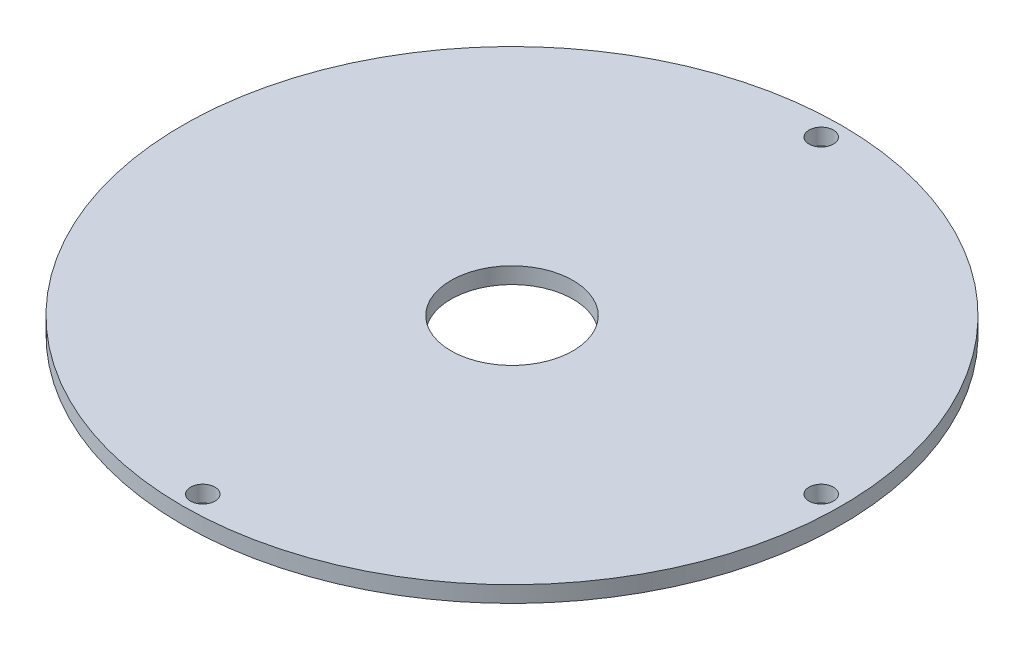
from build123d import *

# Parameters (mm, degrees)
SKETCH1_R           = 40.5
BOSS_EXTRUDE1_DEPTH = 2
SKETCH2_R           = 1.5
CUT_EXTRUDE1_DEPTH  = 2
SKETCH3_R           = 7.5
CUT_EXTRUDE2_DEPTH  = 2


with BuildPart() as part:
    # Sketch1 → Boss-Extrude1 (new body)
    with BuildSketch(Plane(origin=(0, 0, 0), x_dir=(1, 0, 0), z_dir=(0, 1, 0))):
        with Locations(Location((0, 0, 0), (0, 0, 270))):
            Circle(SKETCH1_R)
    extrude(amount=BOSS_EXTRUDE1_DEPTH)

    # Sketch2 → Cut-Extrude1 (cut)
    with BuildSketch(Plane(origin=(0, 2, 0), x_dir=(1, 0, 0), z_dir=(0, 1, 0))):
        with Locations(Location((0, 38, 0), (0, 0, 270))):
            Circle(SKETCH2_R)
        with Locations(Location((38, 0, 0), (0, 0, 270))):
            Circle(SKETCH2_R)
        with Locations(Location((0, -38, 0), (0, 0, 270))):
            Circle(SKETCH2_R)
    extrude(amount=-CUT_EXTRUDE1_DEPTH, mode=Mode.SUBTRACT)

    # Sketch3 → Cut-Extrude2 (cut)
    with BuildSketch(Plane(origin=(0, 2, 0), x_dir=(1, 0, 0), z_dir=(0, 1, 0))):
        with Locations(Location((0, 0, 0), (0, 0, 270))):
            Circle(SKETCH3_R)
    extrude(amount=-CUT_EXTRUDE2_DEPTH, mode=Mode.SUBTRACT)


solid = part.part
